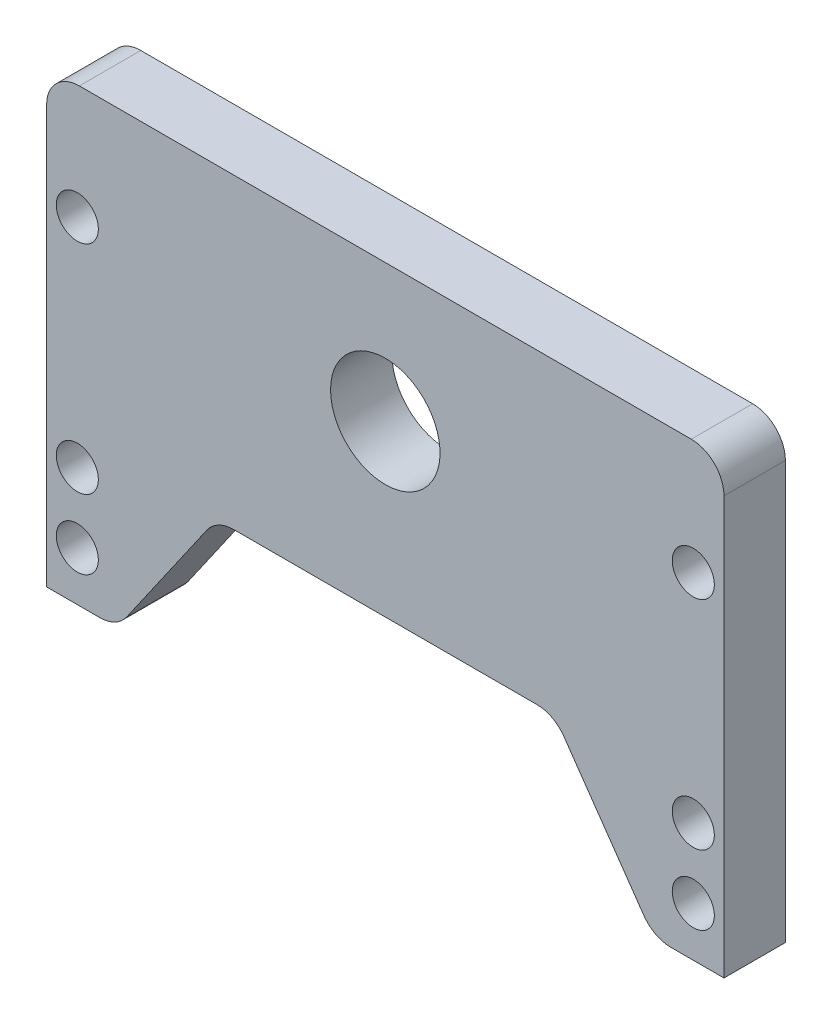
from build123d import *

# Parameters (mm, degrees)
SKETCH1_R           = 1.63195
SKETCH1_R_2         = 4.245922678
BOSS_EXTRUDE1_DEPTH = 4.7625


with BuildPart() as part:
    # Sketch1 → Boss-Extrude1 (new body)
    with BuildSketch(Plane.XY):
        with BuildLine():
            Line((-26.26995, -11.1125), (-22.143527073, -11.1125))
            ThreePointArc((-22.143527073, -11.1125), (-20.967014102, -10.823592453), (-20.058141665, -10.022592307))
            Line((-20.058141665, -10.022592307), (-13.846715616, -1.089907693))
            ThreePointArc((-13.846715616, -1.089907693), (-12.937843178, -0.288907547), (-11.761330208, 0))
            Line((-11.761330208, 0), (11.761330208, 0))
            ThreePointArc((11.761330208, 0), (12.937843178, -0.288907547), (13.846715616, -1.089907693))
            Line((13.846715616, -1.089907693), (20.058141665, -10.022592307))
            ThreePointArc((20.058141665, -10.022592307), (20.967014102, -10.823592453), (22.143527073, -11.1125))
            Line((22.143527073, -11.1125), (26.26995, -11.1125))
            Line((26.26995, -11.1125), (26.26995, 21.2725))
            ThreePointArc((26.26995, 21.2725), (25.526001224, 23.068551224), (23.72995, 23.8125))
            Line((23.72995, 23.8125), (-23.72995, 23.8125))
            ThreePointArc((-23.72995, 23.8125), (-25.526001224, 23.068551224), (-26.26995, 21.2725))
            Line((-26.26995, 21.2725), (-26.26995, -11.1125))
        make_face()
        with Locations(Location((23.8887, 14.931889209, 0), (0, 0, 180))):
            Circle(SKETCH1_R, mode=Mode.SUBTRACT)
        with Locations(Location((23.8887, -7.293110791, 0), (0, 0, 180))):
            Circle(SKETCH1_R, mode=Mode.SUBTRACT)
        with Locations(Location((-23.8887, -7.293110791, 0), (0, 0, 180))):
            Circle(SKETCH1_R, mode=Mode.SUBTRACT)
        with Locations(Location((-23.8887, 14.931889209, 0), (0, 0, 180))):
            Circle(SKETCH1_R, mode=Mode.SUBTRACT)
        with Locations(Location((23.8887, -1.895610791, 0), (0, 0, 180))):
            Circle(SKETCH1_R, mode=Mode.SUBTRACT)
        with Locations(Location((-23.8887, -1.895610791, 0), (0, 0, 180))):
            Circle(SKETCH1_R, mode=Mode.SUBTRACT)
        with Locations(Location((0, 13.141292549, 0), (0, 0, 180))):
            Circle(SKETCH1_R_2, mode=Mode.SUBTRACT)
    extrude(amount=BOSS_EXTRUDE1_DEPTH)


solid = part.part
